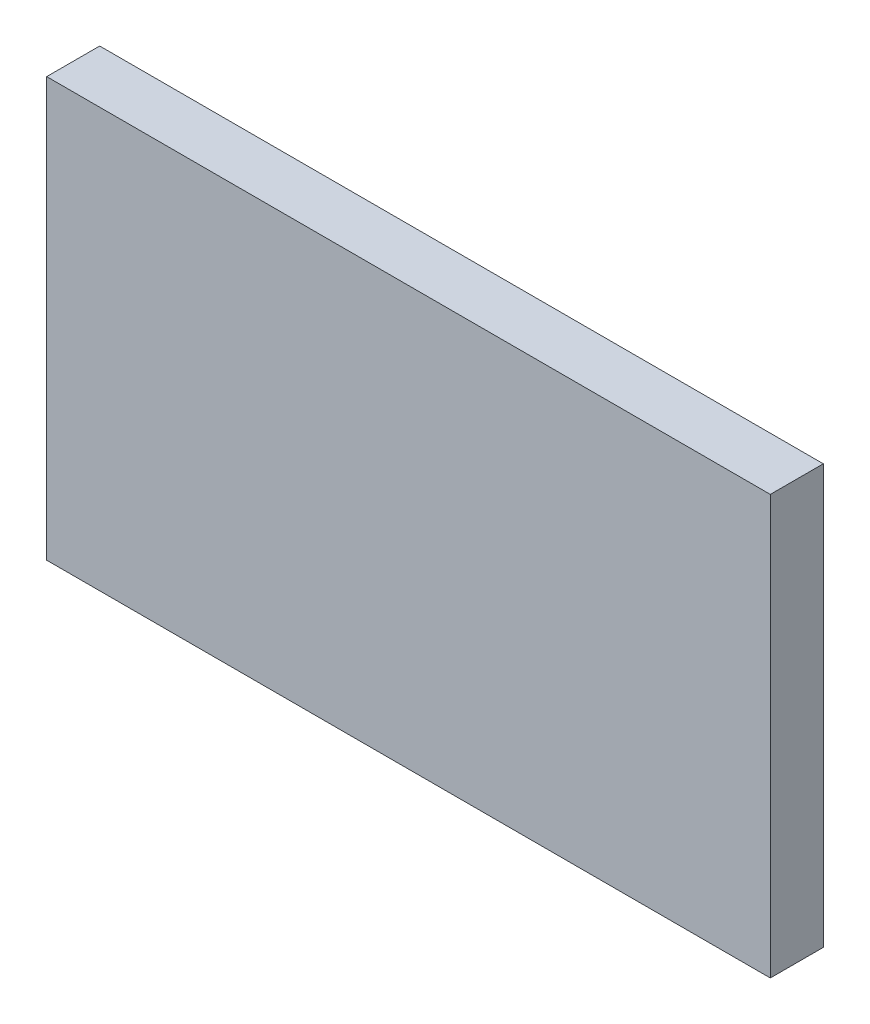
from build123d import *

# Parameters (mm, degrees)
SKETCH1_W           = 457.708
SKETCH1_H           = 264.922
BOSS_EXTRUDE1_DEPTH = 33.528


with BuildPart() as part:
    # Sketch1 → Boss-Extrude1 (new body)
    with BuildSketch(Plane.XY):
        Rectangle(SKETCH1_W, SKETCH1_H)
    extrude(amount=BOSS_EXTRUDE1_DEPTH)


solid = part.part
